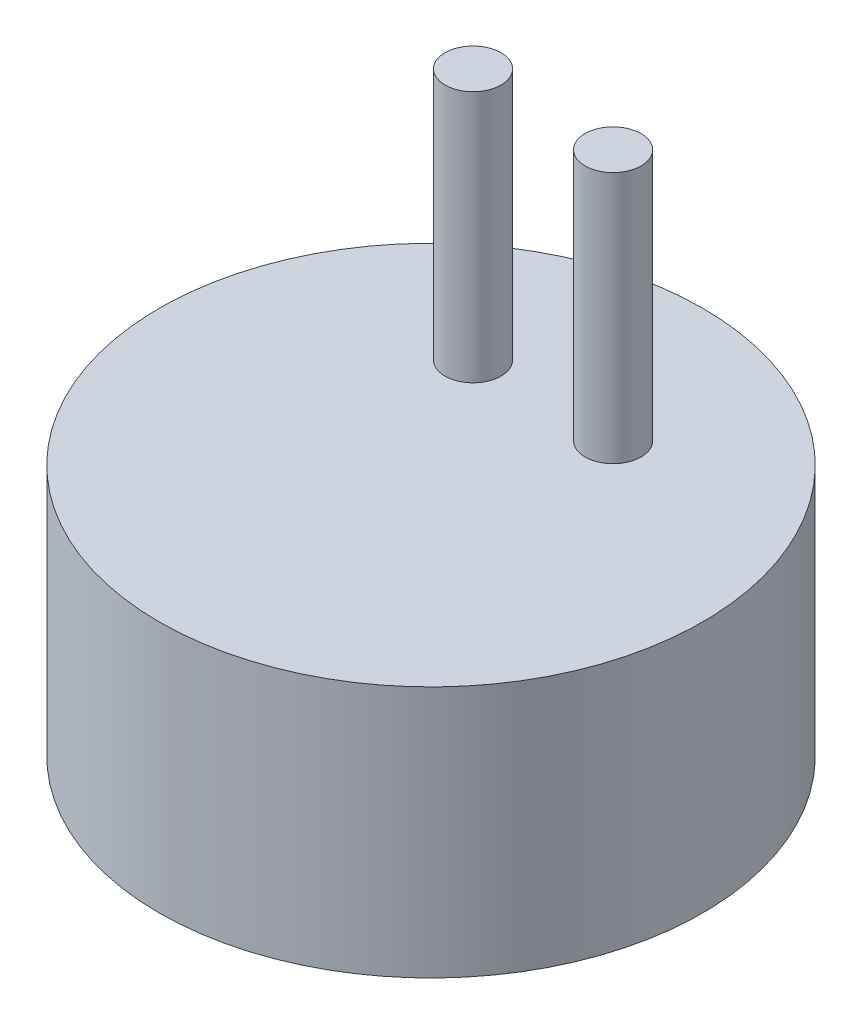
from build123d import *

# Parameters (mm, degrees)
SKETCH_1_R      = 4.85
EXTRUDE_1_DEPTH = 4.5
SKETCH_2_R      = 0.5
EXTRUDE_3_DEPTH = 4.5


with BuildPart() as part:
    # 스케치1 → 보스-돌출1 (new body)
    with BuildSketch(Plane(origin=(0, 0, 0), x_dir=(1, 0, 0), z_dir=(0, 1, 0))):
        with Locations(Location((0, 0, 0), (0, 0, 270))):
            Circle(SKETCH_1_R)
    extrude(amount=EXTRUDE_1_DEPTH)

    # 스케치2 → 보스-돌출3 (add)
    with BuildSketch(Plane(origin=(0, 4.5, 0), x_dir=(1, 0, 0), z_dir=(0, 1, 0))):
        with Locations(Location((1.25, 2, 0), (0, 0, 270))):
            Circle(SKETCH_2_R)
        with Locations(Location((-1.25, 2, 0), (0, 0, 270))):
            Circle(SKETCH_2_R)
    extrude(amount=EXTRUDE_3_DEPTH)


solid = part.part
